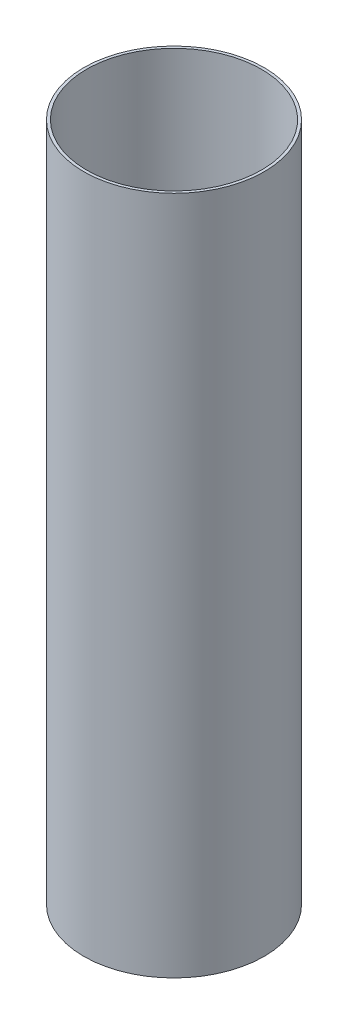
from build123d import *

# Parameters (mm, degrees)
SKETCH3_R           = 51.1048
SKETCH3_R_2         = 49.53
BOSS_EXTRUDE1_DEPTH = 385


with BuildPart() as part:
    # Sketch3 → Boss-Extrude1 (new body)
    with BuildSketch(Plane(origin=(0, 0, 0), x_dir=(1, 0, 0), z_dir=(0, 1, 0))):
        Circle(SKETCH3_R)
        Circle(SKETCH3_R_2, mode=Mode.SUBTRACT)
    extrude(amount=BOSS_EXTRUDE1_DEPTH)


solid = part.part
